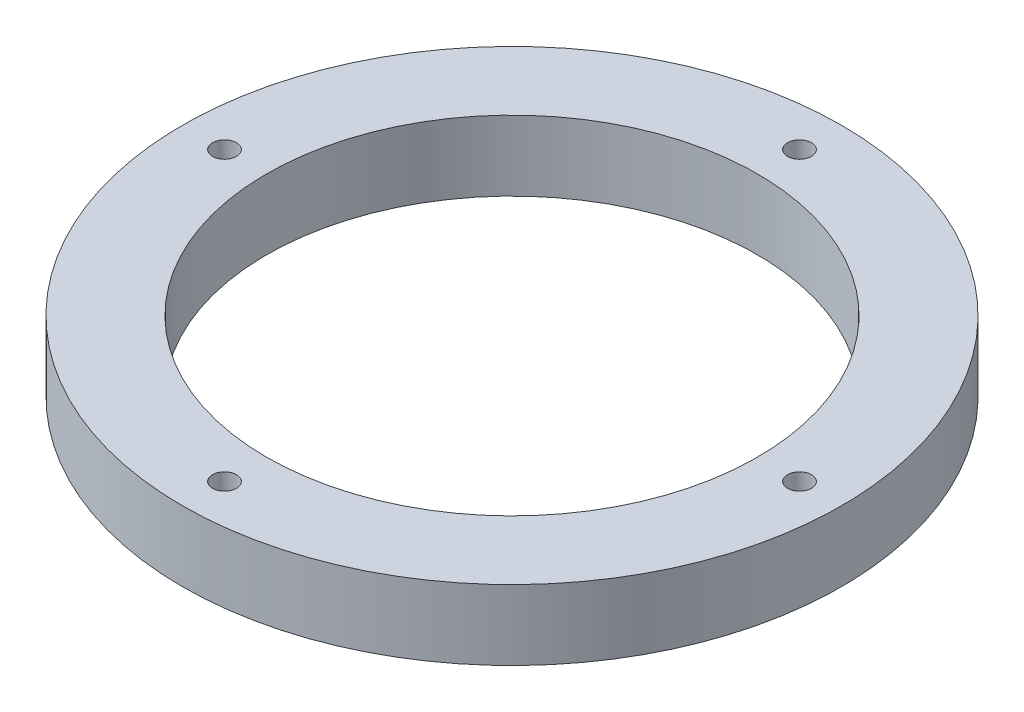
from build123d import *

# Parameters (mm, degrees)
SCHIZZO1_R                             = 47
SCHIZZO1_R_2                           = 35
ESTRUSIONE_ESTRUSIONE1_DEPTH           = 10
FORO_SVASATO_PER_VITE_M3_1_D           = 3.4
FORO_SVASATO_PER_VITE_M3_1_DEPTH       = 188
FORO_SVASATO_PER_VITE_M3_1_CSINK_D     = 6.3
FORO_SVASATO_PER_VITE_M3_1_CSINK_ANGLE = 90
FORO_SVASATO_PER_VITE_M3_1_TIP         = 1.021463052


with BuildPart() as part:
    # Schizzo1 → Estrusione-Estrusione1 (new body)
    with BuildSketch(Plane(origin=(0, 0, 0), x_dir=(1, 0, 0), z_dir=(0, 1, 0))):
        with Locations(Location((0, 0, 0), (0, 0, 270))):
            Circle(SCHIZZO1_R)
        with Locations(Location((0, 0, 0), (0, 0, 270))):
            Circle(SCHIZZO1_R_2, mode=Mode.SUBTRACT)
    extrude(amount=ESTRUSIONE_ESTRUSIONE1_DEPTH)

    # Foro svasato per Vite M3-1
    with Locations(Plane(origin=(-41, 0, 0), x_dir=(0, 0, -1), z_dir=(0, -1, 0))):
        with Locations((0, 0), (41, 41), (0, 82), (-41, 41)):
            CounterSinkHole(FORO_SVASATO_PER_VITE_M3_1_D / 2, FORO_SVASATO_PER_VITE_M3_1_CSINK_D / 2, depth=FORO_SVASATO_PER_VITE_M3_1_DEPTH, counter_sink_angle=FORO_SVASATO_PER_VITE_M3_1_CSINK_ANGLE)
            with Locations((0, 0, -(FORO_SVASATO_PER_VITE_M3_1_DEPTH + FORO_SVASATO_PER_VITE_M3_1_TIP / 2))):  # 118° drill point
                Cone(0, FORO_SVASATO_PER_VITE_M3_1_D / 2, FORO_SVASATO_PER_VITE_M3_1_TIP, mode=Mode.SUBTRACT)


solid = part.part
